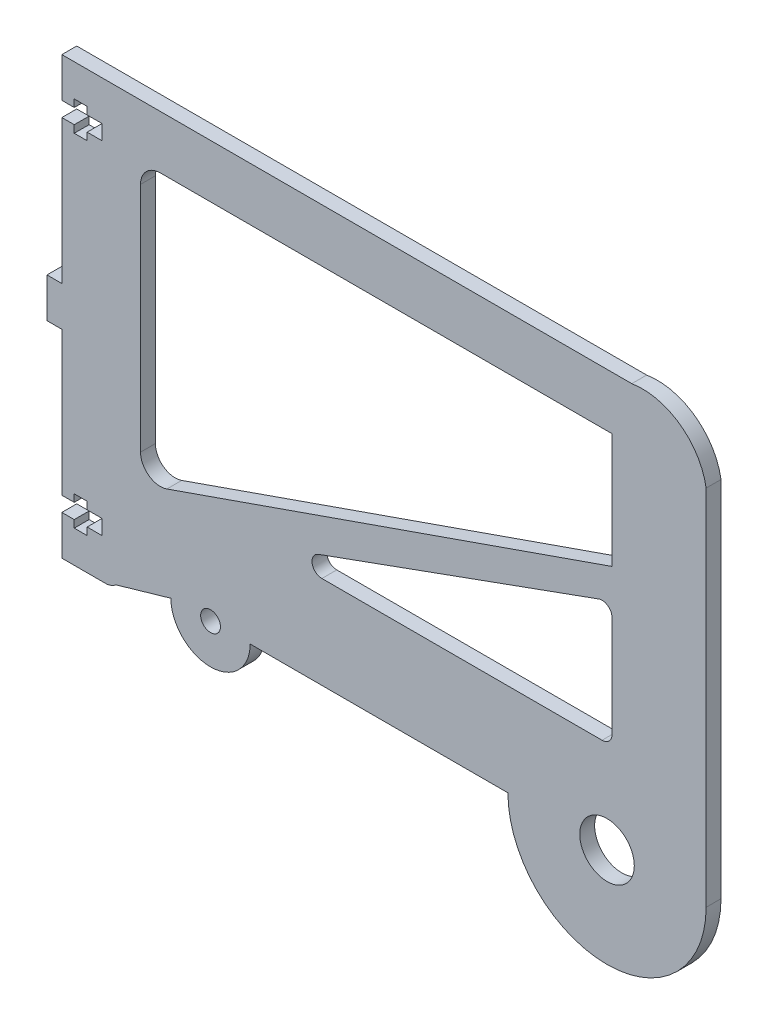
from build123d import *

# Parameters (mm, degrees)
SKETCH_1_R      = 2
SKETCH_1_R_2    = 5.5
EXTRUDE_1_DEPTH = 3


with BuildPart() as part:
    # 草图1 → 凸台-拉伸1 (new body)
    with BuildSketch(Plane.XY):
        with BuildLine():
            Line((234.002581869, 13.707860978), (182.002581869, 13.707860978))
            ThreePointArc((182.002581869, 13.707860978), (174.002581869, 5.707860978), (166.002581869, 13.707860978))
            Line((166.002581869, 13.707860978), (154.850930387, 10.484571811))
            ThreePointArc((154.850930387, 10.484571811), (153.916116795, 9.908765811), (152.836734449, 9.707860978))
            Line((152.836734449, 9.707860978), (144.002581869, 9.707860978))
            Line((144.002581869, 9.707860978), (144.002581869, 17.707860978))
            Line((144.002581869, 17.707860978), (146.502581869, 17.707860978))
            Line((146.502581869, 17.707860978), (146.502581869, 16.207860978))
            Line((146.502581869, 16.207860978), (149.102581869, 16.207860978))
            Line((149.102581869, 16.207860978), (149.102581869, 17.707860978))
            Line((149.102581869, 17.707860978), (152.102581869, 17.707860978))
            Line((152.102581869, 17.707860978), (152.102581869, 20.707860978))
            Line((152.102581869, 20.707860978), (149.102581869, 20.707860978))
            Line((149.102581869, 20.707860978), (149.102581869, 22.207860978))
            Line((149.102581869, 22.207860978), (146.502581869, 22.207860978))
            Line((146.502581869, 22.207860978), (146.502581869, 20.707860978))
            Line((146.502581869, 20.707860978), (144.002581869, 20.707860978))
            Line((144.002581869, 20.707860978), (144.002581869, 49.707860978))
            Line((144.002581869, 49.707860978), (141.002581869, 49.707860978))
            Line((141.002581869, 49.707860978), (141.002581869, 57.707860978))
            Line((141.002581869, 57.707860978), (144.002581869, 57.707860978))
            Line((144.002581869, 57.707860978), (144.002581869, 86.707860978))
            Line((144.002581869, 86.707860978), (146.502581869, 86.707860978))
            Line((146.502581869, 86.707860978), (146.502581869, 85.207860978))
            Line((146.502581869, 85.207860978), (149.102581869, 85.207860978))
            Line((149.102581869, 85.207860978), (149.102581869, 86.707860978))
            Line((149.102581869, 86.707860978), (152.102581869, 86.707860978))
            Line((152.102581869, 86.707860978), (152.102581869, 89.707860978))
            Line((152.102581869, 89.707860978), (149.102581869, 89.707860978))
            Line((149.102581869, 89.707860978), (149.102581869, 91.207860978))
            Line((149.102581869, 91.207860978), (146.502581869, 91.207860978))
            Line((146.502581869, 91.207860978), (146.502581869, 89.707860978))
            Line((146.502581869, 89.707860978), (144.002581869, 89.707860978))
            Line((144.002581869, 89.707860978), (144.002581869, 97.707860978))
            Line((144.002581869, 97.707860978), (154.002581869, 97.707860978))
            Line((154.002581869, 97.707860978), (259.002581869, 97.707860978))
            ThreePointArc((259.002581869, 97.707860978), (268.727085047, 95.444036955), (274.002581869, 86.967009497))
            Line((274.002581869, 86.967009497), (274.002581869, 13.707860978))
            ThreePointArc((274.002581869, 13.707860978), (254.002581869, -6.292139022), (234.002581869, 13.707860978))
        make_face()
        with Locations((174.002581869, 13.707860978)):
            Circle(SKETCH_1_R, mode=Mode.SUBTRACT)
        with Locations((254.002581869, 13.707860978)):
            Circle(SKETCH_1_R_2, mode=Mode.SUBTRACT)
        with BuildLine():
            Line((165.194921817, 32.396144085), (255.002581869, 63.765533121))
            Line((255.002581869, 63.765533121), (255.002581869, 86.967009497))
            Line((255.002581869, 86.967009497), (163.875891268, 86.967009497))
            ThreePointArc((163.875891268, 86.967009497), (161.047464143, 85.795436622), (159.875891268, 82.967009497))
            Line((159.875891268, 82.967009497), (159.875891268, 36.172406577))
            ThreePointArc((159.875891268, 36.172406577), (161.560305186, 32.910802508), (165.194921817, 32.396144085))
        make_face(mode=Mode.SUBTRACT)
        with BuildLine():
            Line((195.793134982, 36.276744779), (252.321890288, 56.737573029))
            ThreePointArc((252.321890288, 56.737573029), (254.151193387, 56.494254101), (255.002581869, 54.856972335))
            Line((255.002581869, 54.856972335), (255.002581869, 34.396144085))
            ThreePointArc((255.002581869, 34.396144085), (254.416795432, 32.981930522), (253.002581869, 32.396144085))
            Line((253.002581869, 32.396144085), (196.473826563, 32.396144085))
            ThreePointArc((196.473826563, 32.396144085), (194.50390253, 34.050602038), (195.793134982, 36.276744779))
        make_face(mode=Mode.SUBTRACT)
    extrude(amount=EXTRUDE_1_DEPTH)


solid = part.part
